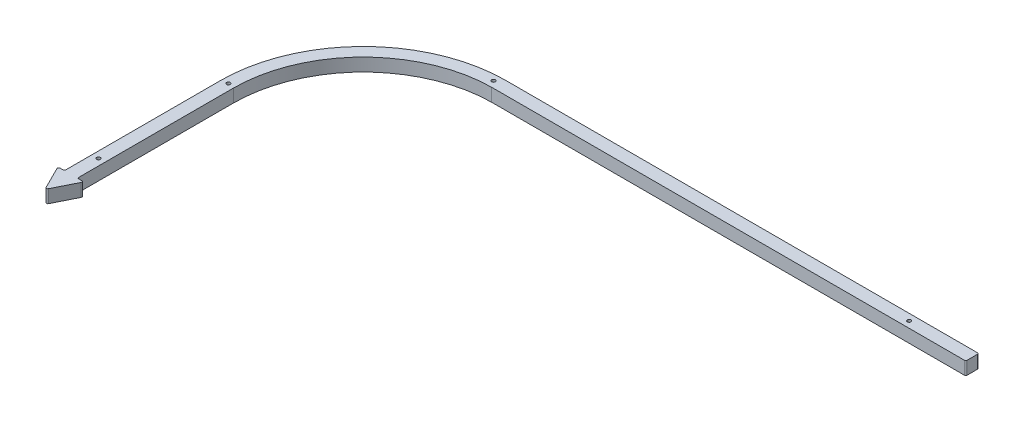
from build123d import *

# Parameters (mm, degrees)
SKETCH1_W           = 231.775
SKETCH1_H           = 6.350433672
SKETCH1_W_2         = 6.35
SKETCH1_H_2         = 76.2
SKETCH1_H_3         = 12.7
SKETCH1_W_3         = 3.175
BOSS_EXTRUDE1_DEPTH = 6.35
CUT_EXTRUDE1_DEPTH  = 341.219392139
FILLET1_R           = 0.635
SKETCH3_R           = 0.889
CUT_EXTRUDE2_DEPTH  = 341.219392139


with BuildPart() as part:
    # Sketch1 → Boss-Extrude1 (new body)
    with BuildSketch(Plane(origin=(0, 0, 0), x_dir=(1, 0, 0), z_dir=(0, 1, 0))):
        with Locations((184.959182845, 155.570446755)):
            Rectangle(SKETCH1_W, SKETCH1_H)
        with BuildLine():
            Line((69.071682845, 152.395229919), (69.071682845, 158.745663591))
            ThreePointArc((69.071682845, 158.745663591), (20.184176976, 138.015461144), (0, 88.9))
            Line((0, 88.9), (6.35, 88.9))
            ThreePointArc((6.35, 88.9), (24.674380805, 133.525255521), (69.071682845, 152.395229919))
        make_face()
        with Locations((3.175, 50.8)):
            Rectangle(SKETCH1_W_2, SKETCH1_H_2)
        with Locations((3.175, 6.35)):
            Rectangle(SKETCH1_W_2, SKETCH1_H_3)
        with Locations((-1.5875, 6.35)):
            Rectangle(SKETCH1_W_3, SKETCH1_H_3)
        with Locations((7.9375, 6.35)):
            Rectangle(SKETCH1_W_3, SKETCH1_H_3)
    extrude(amount=BOSS_EXTRUDE1_DEPTH)

    # Sketch2 → Cut-Extrude1 (cut, through all)
    with BuildSketch(Plane(origin=(0, 6.35, 0), x_dir=(1, 0, 0), z_dir=(0, 1, 0))):
        Polygon((3.175, 0), (-3.175, 12.7), (-3.175, 0), align=None)
        Polygon((9.525, 12.7), (3.175, 0), (9.525, 0), align=None)
    extrude(amount=-CUT_EXTRUDE1_DEPTH, mode=Mode.SUBTRACT)

    # Fillet1
    fillet1_edges = [part.edges().sort_by_distance(p)[0] for p in [
        (0, 3.175, -12.7),
        (300.846682845, 3.175, -158.745663591),
        (300.846682845, 3.175, -152.395229919),
        (6.35, 3.175, -12.7),
        (-3.175, 3.175, -12.7),
        (9.525, 3.175, -12.7),
        (3.175, 3.175, 0),
    ]]
    fillet(fillet1_edges, radius=FILLET1_R)

    # Sketch3 → Cut-Extrude2 (cut, through all)
    with BuildSketch(Plane(origin=(0, 6.35, 0), x_dir=(1, 0, 0), z_dir=(0, 1, 0))):
        with Locations(Location((3.175, 26.184903166, 0), (0, 0, 270))):
            Circle(SKETCH3_R)
        with Locations(Location((3.175, 89.684903166, 0), (0, 0, 270))):
            Circle(SKETCH3_R)
        with Locations(Location((66.802, 155.570446755, 0), (0, 0, 270))):
            Circle(SKETCH3_R)
        with Locations(Location((270.002, 155.570446755, 0), (0, 0, 270))):
            Circle(SKETCH3_R)
    extrude(amount=-CUT_EXTRUDE2_DEPTH, mode=Mode.SUBTRACT)


solid = part.part
